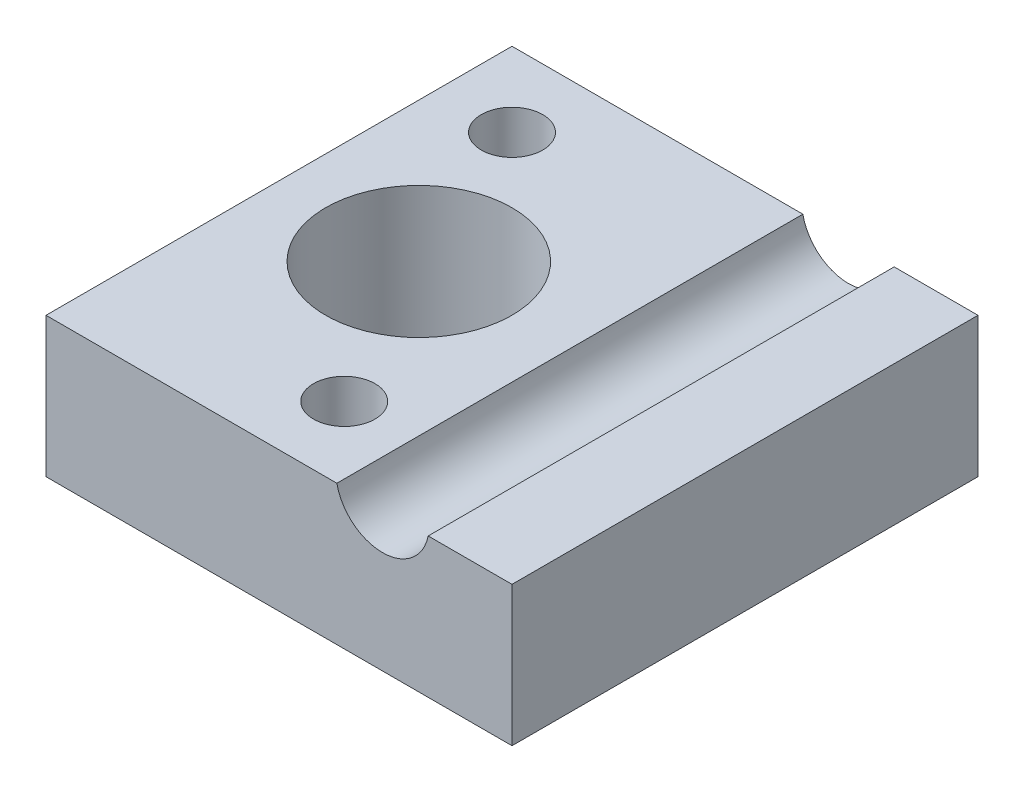
from build123d import *

# Parameters (mm, degrees)
BOSS_EXTRU_1_DEPTH                                 = 50
CHAMBRAGE_POUR_VIS_T_TE_HEXAGONALE_M62_D           = 6.6
CHAMBRAGE_POUR_VIS_T_TE_HEXAGONALE_M62_CBORE_D     = 11
CHAMBRAGE_POUR_VIS_T_TE_HEXAGONALE_M62_CBORE_DEPTH = 6.4
ESQUISSE5_R                                        = 10
ENL_V_MAT_EXTRU_1_DEPTH                            = 64.472923802


with BuildPart() as part:
    # Esquisse1 → Boss.-Extru.1 (new body)
    with BuildSketch(Plane.XY):
        with BuildLine():
            Line((-36.108337762, -1), (-36.108337762, -16))
            Line((-36.108337762, -16), (13.891662238, -16))
            Line((13.891662238, -16), (13.891662238, -1))
            Line((13.891662238, -1), (4.898979486, -1))
            ThreePointArc((4.898979486, -1), (0, -5), (-4.898979486, -1))
            Line((-4.898979486, -1), (-36.108337762, -1))
        make_face()
    extrude(amount=BOSS_EXTRU_1_DEPTH)

    # Chambrage pour vis à tête hexagonale M62 (through all)
    with Locations(Plane(origin=(0, -16, 0), x_dir=(-1, 0, 0), z_dir=(0, -1, 0))):
        with Locations((12.108337762, -42), (28.108337762, -8)):
            CounterBoreHole(CHAMBRAGE_POUR_VIS_T_TE_HEXAGONALE_M62_D / 2, CHAMBRAGE_POUR_VIS_T_TE_HEXAGONALE_M62_CBORE_D / 2, CHAMBRAGE_POUR_VIS_T_TE_HEXAGONALE_M62_CBORE_DEPTH)

    # Esquisse5 → Enlèv. mat.-Extru.1 (cut, through all)
    with BuildSketch(Plane(origin=(0, -16, 0), x_dir=(-1, 0, 0), z_dir=(0, -1, 0))):
        with Locations(Location((21.108337762, -25, 0), (0, 0, 90))):
            Circle(ESQUISSE5_R)
    extrude(amount=-ENL_V_MAT_EXTRU_1_DEPTH, mode=Mode.SUBTRACT)


solid = part.part
